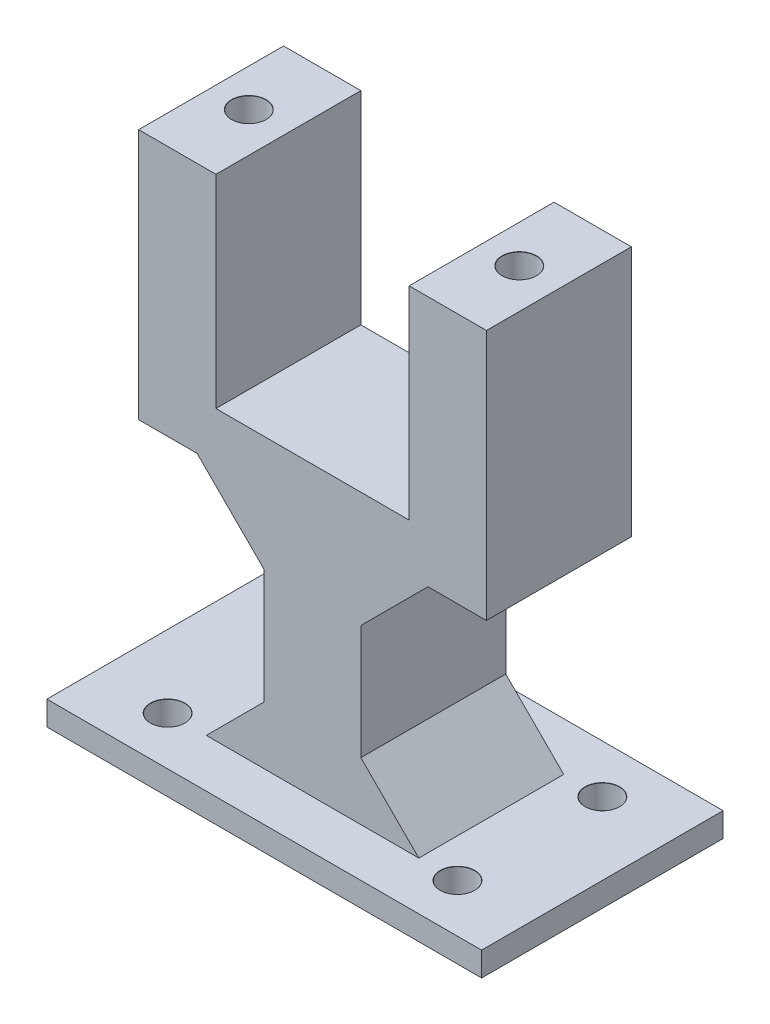
from build123d import *

# Parameters (mm, degrees)
SKETCH1_W                      = 57.15
SKETCH1_H                      = 31.75
BOSS_EXTRUDE1_DEPTH            = 3.175
M4_CLEARANCE_HOLE1_D           = 4.5
M4_CLEARANCE_HOLE1_CSINK_D     = 4.55
M4_CLEARANCE_HOLE1_CSINK_ANGLE = 90
SKETCH5_W                      = 12.7
SKETCH5_H                      = 37.846
BOSS_EXTRUDE2_DEPTH            = 9.525
BOSS_EXTRUDE3_DEPTH            = 9.525
M4_CLEARANCE_HOLE2_D           = 4.5
M4_CLEARANCE_HOLE2_DEPTH       = 33.02
M4_CLEARANCE_HOLE2_CSINK_D     = 4.55
M4_CLEARANCE_HOLE2_CSINK_ANGLE = 90
M4_CLEARANCE_HOLE2_TIP         = 1.351936393


with BuildPart() as part:
    # Sketch1 → Boss-Extrude1 (new body)
    with BuildSketch(Plane(origin=(0, 0, 0), x_dir=(1, 0, 0), z_dir=(0, 1, 0))):
        Rectangle(SKETCH1_W, SKETCH1_H)
    extrude(amount=BOSS_EXTRUDE1_DEPTH)

    # M4 Clearance Hole1 (through all)
    with Locations(Plane(origin=(0, 3.175, 0), x_dir=(1, 0, 0), z_dir=(0, 1, 0))):
        with Locations((-19.05, 9.525), (19.05, 9.525), (19.05, -9.525), (-19.05, -9.525)):
            CounterSinkHole(M4_CLEARANCE_HOLE1_D / 2, M4_CLEARANCE_HOLE1_CSINK_D / 2, counter_sink_angle=M4_CLEARANCE_HOLE1_CSINK_ANGLE)

    # Sketch5 → Boss-Extrude2 (add, symmetric)
    with BuildSketch(Plane.XY):
        with Locations((0, 22.098)):
            Rectangle(SKETCH5_W, SKETCH5_H)
    extrude(amount=BOSS_EXTRUDE2_DEPTH, both=True)

    # Sketch6 → Boss-Extrude3 (add, symmetric)
    with BuildSketch(Plane.XY):
        Polygon((6.35, 41.021), (12.7, 41.021), (12.7, 67.691), (22.86, 67.691), (22.86, 34.671), (15.175054079, 34.671), (6.35, 25.845945921), align=None)
        Polygon((-6.35, 41.021), (-12.7, 41.021), (-12.7, 67.691), (-22.86, 67.691), (-22.86, 34.671), (-15.175054079, 34.671), (-6.35, 25.845945921), align=None)
        Polygon((-6.35, 10.795), (-13.97, 3.175), (-6.35, 3.175), align=None)
        Polygon((6.35, 3.175), (6.35, 10.795), (13.97, 3.175), align=None)
    extrude(amount=BOSS_EXTRUDE3_DEPTH, both=True)

    # M4 Clearance Hole2
    with Locations(Plane(origin=(0, 67.691, 0), x_dir=(1, 0, 0), z_dir=(0, 1, 0))):
        with Locations((-17.903194087, 0), (17.656805913, 0)):
            CounterSinkHole(M4_CLEARANCE_HOLE2_D / 2, M4_CLEARANCE_HOLE2_CSINK_D / 2, depth=M4_CLEARANCE_HOLE2_DEPTH, counter_sink_angle=M4_CLEARANCE_HOLE2_CSINK_ANGLE)
            with Locations((0, 0, -(M4_CLEARANCE_HOLE2_DEPTH + M4_CLEARANCE_HOLE2_TIP / 2))):  # 118° drill point
                Cone(0, M4_CLEARANCE_HOLE2_D / 2, M4_CLEARANCE_HOLE2_TIP, mode=Mode.SUBTRACT)


solid = part.part
